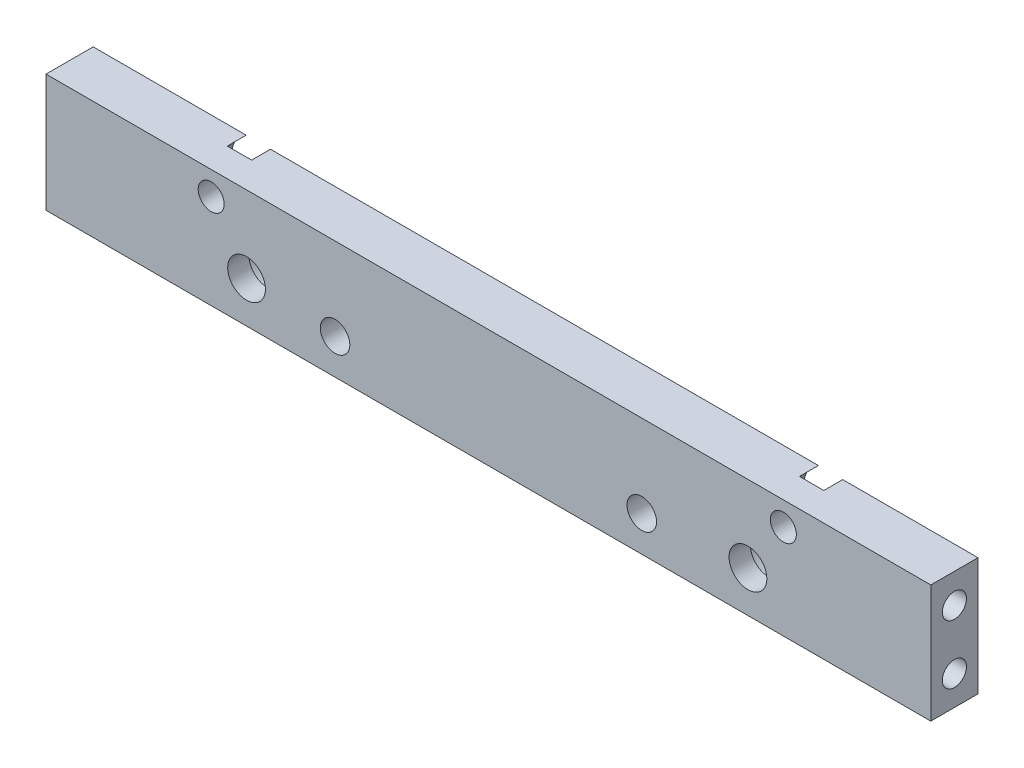
from build123d import *

# Parameters (mm, degrees)
SKETCH1_W                                        = 75
SKETCH1_H                                        = 10
BOSS_EXTRUDE1_DEPTH                              = 4
F_2_5_2_5_DIAMETER_HOLE1_D                       = 2.5
CBORE_FOR_M3_HEX_HEAD_MACHINE_SCREW1_D           = 3.2
CBORE_FOR_M3_HEX_HEAD_MACHINE_SCREW1_CBORE_D     = 5.8
CBORE_FOR_M3_HEX_HEAD_MACHINE_SCREW1_CBORE_DEPTH = 2.2
CBORE_FOR_M2_HEX_HEAD_MACHINE_SCREW1_D           = 2.2
CBORE_FOR_M2_HEX_HEAD_MACHINE_SCREW1_CBORE_D     = 4.499999997
CBORE_FOR_M2_HEX_HEAD_MACHINE_SCREW1_CBORE_DEPTH = 1.6
F_2_05_2_05_DIAMETER_HOLE1_D                     = 2.05
F_2_05_2_05_DIAMETER_HOLE1_DEPTH                 = 8
F_2_05_2_05_DIAMETER_HOLE1_TIP                   = 0.615882135
F_2_05_2_05_DIAMETER_HOLE2_D                     = 2.05
F_2_05_2_05_DIAMETER_HOLE2_DEPTH                 = 8
F_2_05_2_05_DIAMETER_HOLE2_TIP                   = 0.615882135


with BuildPart() as part:
    # Sketch1 → Boss-Extrude1 (new body)
    with BuildSketch(Plane.XY.offset(4)):
        Rectangle(SKETCH1_W, SKETCH1_H)
    extrude(amount=-BOSS_EXTRUDE1_DEPTH)

    # Ø2.5 (2.5) Diameter Hole1 (through all)
    with Locations(Plane(origin=(0, 0, 0), x_dir=(-1, 0, 0), z_dir=(0, 0, -1))):
        with Locations((-13, -2), (13, -2)):
            Hole(F_2_5_2_5_DIAMETER_HOLE1_D / 2)

    # CBORE for M3 Hex Head Machine Screw1 (through all)
    with Locations(Plane(origin=(0, 0, 0), x_dir=(-1, 0, 0), z_dir=(0, 0, -1))):
        with Locations((-22, -1.5), (20.5, -1.5)):
            CounterBoreHole(CBORE_FOR_M3_HEX_HEAD_MACHINE_SCREW1_D / 2, CBORE_FOR_M3_HEX_HEAD_MACHINE_SCREW1_CBORE_D / 2, CBORE_FOR_M3_HEX_HEAD_MACHINE_SCREW1_CBORE_DEPTH)

    # CBORE for M2 Hex Head Machine Screw1 (through all)
    with Locations(Plane(origin=(0, 0, 0), x_dir=(-1, 0, 0), z_dir=(0, 0, -1))):
        with Locations((23.5, 3), (-25, 3)):
            CounterBoreHole(CBORE_FOR_M2_HEX_HEAD_MACHINE_SCREW1_D / 2, CBORE_FOR_M2_HEX_HEAD_MACHINE_SCREW1_CBORE_D / 2, CBORE_FOR_M2_HEX_HEAD_MACHINE_SCREW1_CBORE_DEPTH)

    # Ø2.05 (2.05) Diameter Hole1
    with Locations(Plane(origin=(37.5, 0, 0), x_dir=(0, 0, -1), z_dir=(1, 0, 0))):
        with Locations((-2, 2.5), (-2, -2.5)):
            Hole(F_2_05_2_05_DIAMETER_HOLE1_D / 2, depth=F_2_05_2_05_DIAMETER_HOLE1_DEPTH)
            with Locations((0, 0, -(F_2_05_2_05_DIAMETER_HOLE1_DEPTH + F_2_05_2_05_DIAMETER_HOLE1_TIP / 2))):  # 118° drill point
                Cone(0, F_2_05_2_05_DIAMETER_HOLE1_D / 2, F_2_05_2_05_DIAMETER_HOLE1_TIP, mode=Mode.SUBTRACT)

    # Ø2.05 (2.05) Diameter Hole2
    with Locations(Plane.ZY.offset(37.5)):
        with Locations((2, -2.5), (2, 2.5)):
            Hole(F_2_05_2_05_DIAMETER_HOLE2_D / 2, depth=F_2_05_2_05_DIAMETER_HOLE2_DEPTH)
            with Locations((0, 0, -(F_2_05_2_05_DIAMETER_HOLE2_DEPTH + F_2_05_2_05_DIAMETER_HOLE2_TIP / 2))):  # 118° drill point
                Cone(0, F_2_05_2_05_DIAMETER_HOLE2_D / 2, F_2_05_2_05_DIAMETER_HOLE2_TIP, mode=Mode.SUBTRACT)


solid = part.part
